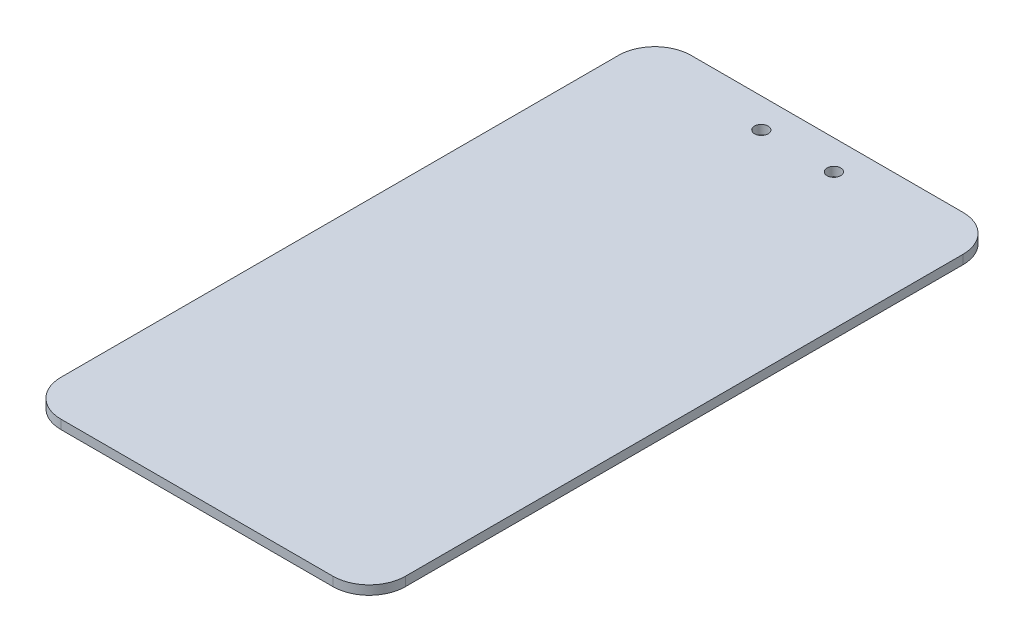
from build123d import *

# Parameters (mm, degrees)
SKETCH1_R           = 1.5
BOSS_EXTRUDE1_DEPTH = 2


with BuildPart() as part:
    # Sketch1 → Boss-Extrude1 (new body)
    with BuildSketch(Plane(origin=(0, 0, 0), x_dir=(1, 0, 0), z_dir=(0, 1, 0))):
        with BuildLine():
            Line((8, 0), (68, 0))
            ThreePointArc((68, 0), (73.656854249, 2.343145751), (76, 8))
            Line((76, 8), (76, 131))
            ThreePointArc((76, 131), (73.656854249, 136.656854249), (68, 139))
            Line((68, 139), (8, 139))
            ThreePointArc((8, 139), (2.343145751, 136.656854249), (0, 131))
            Line((0, 131), (0, 8))
            ThreePointArc((0, 8), (2.343145751, 2.343145751), (8, 0))
        make_face()
        with Locations(Location((46, 132.5, 0), (0, 0, 270))):
            Circle(SKETCH1_R, mode=Mode.SUBTRACT)
        with Locations(Location((30, 132.5, 0), (0, 0, 90))):
            Circle(SKETCH1_R, mode=Mode.SUBTRACT)
    extrude(amount=BOSS_EXTRUDE1_DEPTH)


solid = part.part
